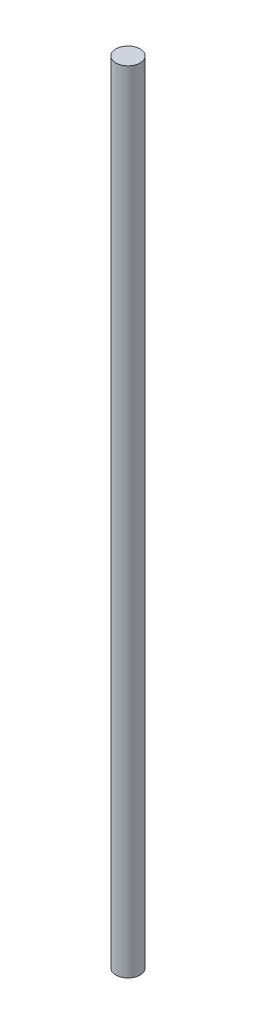
from build123d import *

# Parameters (mm, degrees)
SKETCH1_R           = 4
BOSS_EXTRUDE1_DEPTH = 260


with BuildPart() as part:
    # Sketch1 → Boss-Extrude1 (new body)
    with BuildSketch(Plane(origin=(0, 0, 0), x_dir=(1, 0, 0), z_dir=(0, 1, 0))):
        with Locations(Location((0, 0, 0), (0, 0, 270))):
            Circle(SKETCH1_R)
    extrude(amount=BOSS_EXTRUDE1_DEPTH)


solid = part.part
